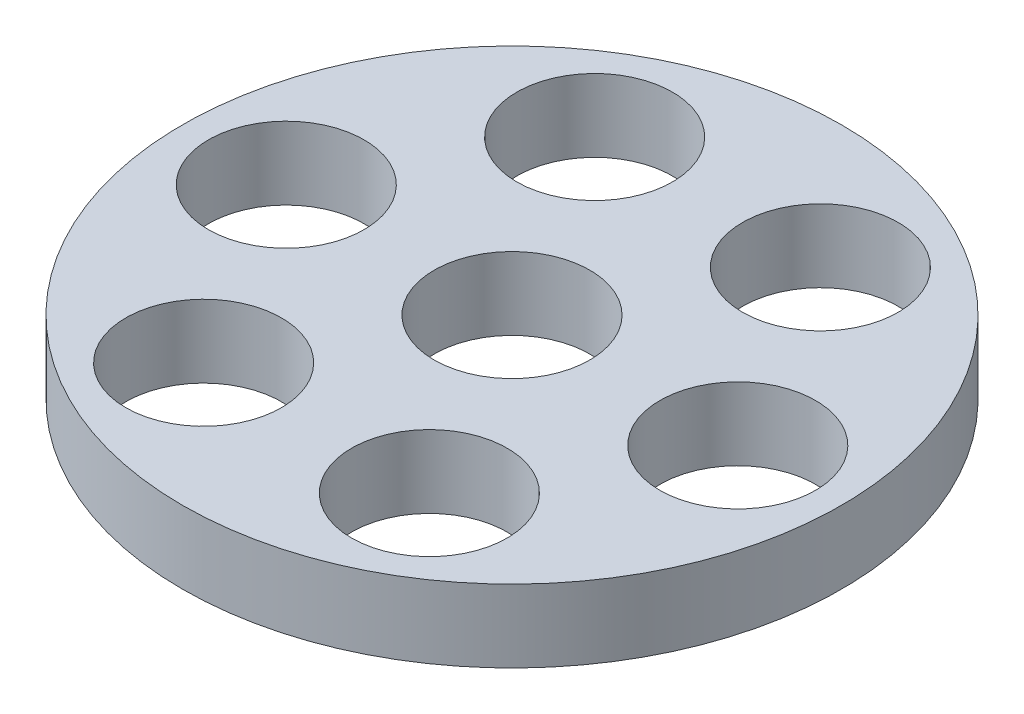
from build123d import *

# Parameters (mm, degrees)
ESBO_O1_R                = 31.75
RESSALTO_EXTRUS_O1_DEPTH = 7
ESBO_O2_R                = 7.5
CORTE_EXTRUS_O1_DEPTH    = 10


with BuildPart() as part:
    # Esboço1 → Ressalto-extrusão1 (new body)
    with BuildSketch(Plane(origin=(0, 0, 0), x_dir=(1, 0, 0), z_dir=(0, 1, 0))):
        with Locations(Location((0, 0, 0), (0, 0, 270))):
            Circle(ESBO_O1_R)
    extrude(amount=-RESSALTO_EXTRUS_O1_DEPTH)

    # Esboço2 → Corte-extrusão1 (cut)
    with BuildSketch(Plane(origin=(0, 0, 0), x_dir=(1, 0, 0), z_dir=(0, 1, 0))):
        with Locations(Location((21.75, 0, 0), (0, 0, 270))):
            Circle(ESBO_O2_R)
        with Locations(Location((10.8755, -18.835186507, 0), (0, 0, 270))):
            Circle(ESBO_O2_R)
        with Locations(Location((-10.8735, -18.835186507, 0), (0, 0, 270))):
            Circle(ESBO_O2_R)
        with Locations(Location((-21.748, 0, 0), (0, 0, 270))):
            Circle(ESBO_O2_R)
        with Locations(Location((0.0015, -0.000866025, 0), (0, 0, 270))):
            Circle(ESBO_O2_R)
        with Locations(Location((-10.8735, 18.835186507, 0), (0, 0, 270))):
            Circle(ESBO_O2_R)
        with Locations(Location((10.8755, 18.835186507, 0), (0, 0, 270))):
            Circle(ESBO_O2_R)
    extrude(amount=-CORTE_EXTRUS_O1_DEPTH, mode=Mode.SUBTRACT)


solid = part.part
